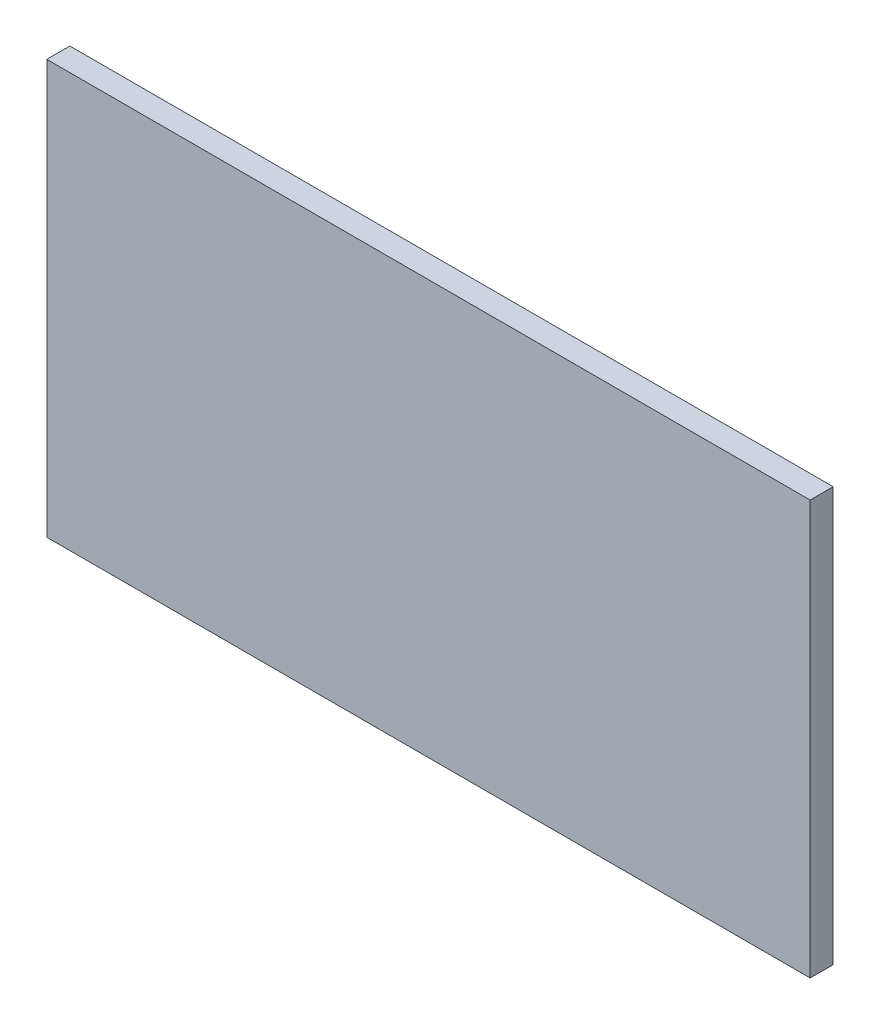
from build123d import *

# Parameters (mm, degrees)
SKETCH1_W               = 33.127
SKETCH1_H               = 17.9635
COMPONENT_OUTLINE_DEPTH = 1


with BuildPart() as part:
    # Sketch1 → Component_Outline (new body)
    with BuildSketch(Plane.XY):
        with Locations((0.5, -0.41825)):
            Rectangle(SKETCH1_W, SKETCH1_H)
    extrude(amount=COMPONENT_OUTLINE_DEPTH)


solid = part.part
